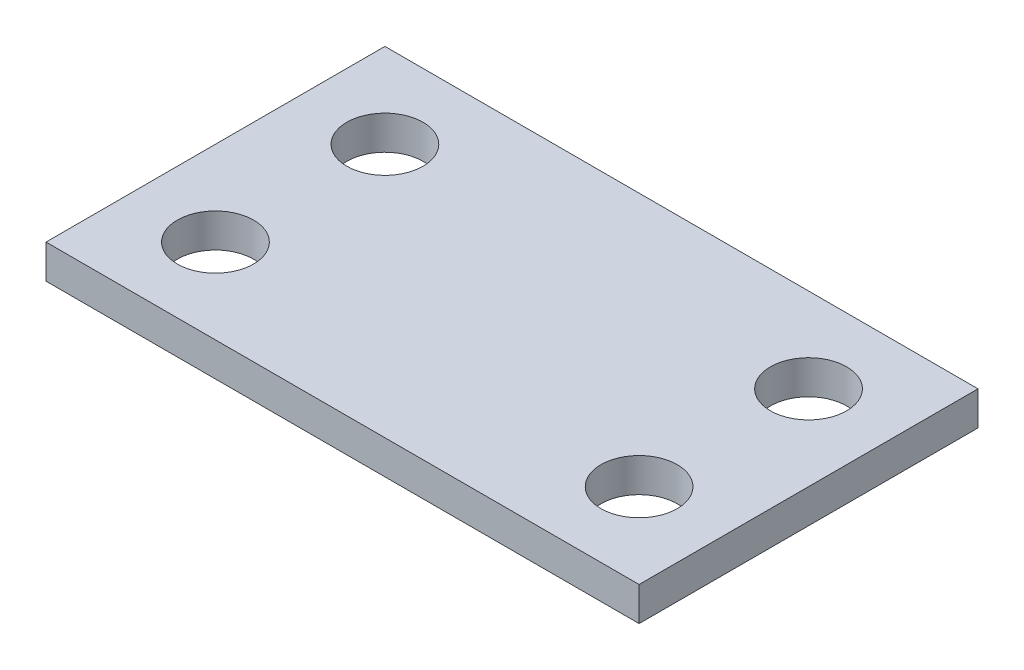
from build123d import *

# Parameters (mm, degrees)
SZKIC1_W                    = 140
SZKIC1_H                    = 80
SZKIC1_R                    = 9
DODANIE_WYCI_GNI_CIE1_DEPTH = 8


with BuildPart() as part:
    # Szkic1 → Dodanie-wyciągnięcie1 (new body)
    with BuildSketch(Plane(origin=(0, 0, 0), x_dir=(1, 0, 0), z_dir=(0, 1, 0))):
        with Locations((70, 40)):
            Rectangle(SZKIC1_W, SZKIC1_H)
        with Locations(Location((20, 60, 0), (0, 0, 270))):
            Circle(SZKIC1_R, mode=Mode.SUBTRACT)
        with Locations(Location((120, 60, 0), (0, 0, 270))):
            Circle(SZKIC1_R, mode=Mode.SUBTRACT)
        with Locations(Location((120, 20, 0), (0, 0, 270))):
            Circle(SZKIC1_R, mode=Mode.SUBTRACT)
        with Locations(Location((20, 20, 0), (0, 0, 270))):
            Circle(SZKIC1_R, mode=Mode.SUBTRACT)
    extrude(amount=DODANIE_WYCI_GNI_CIE1_DEPTH)


solid = part.part
